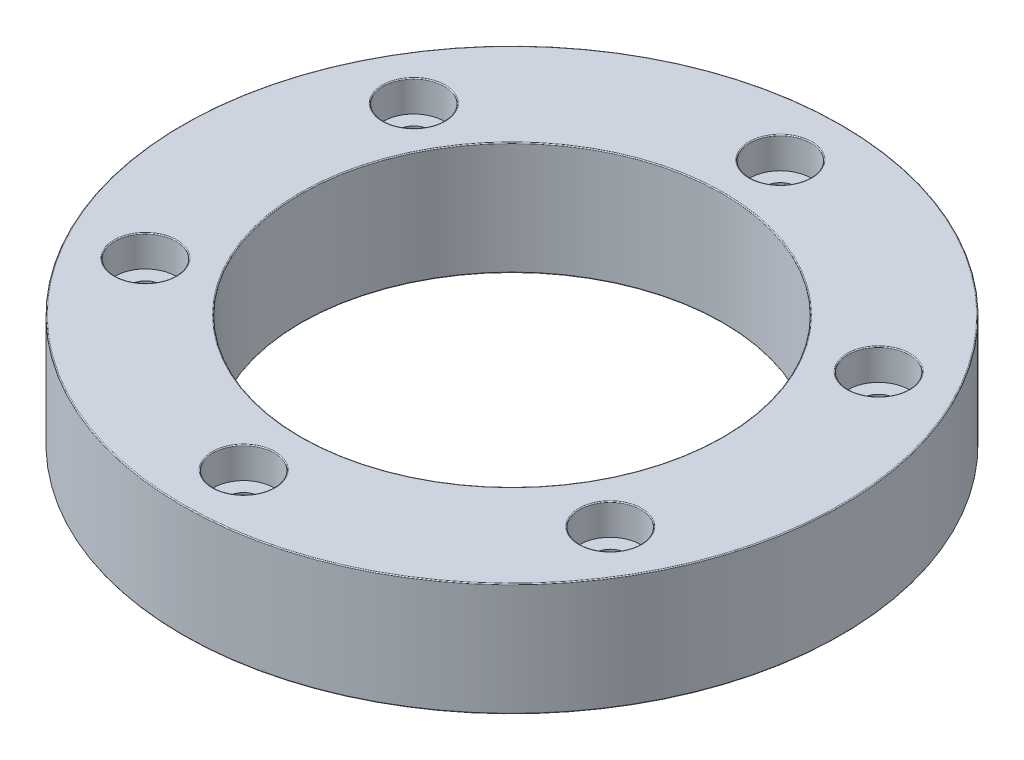
from build123d import *

# Parameters (mm, degrees)
SKETCH1_R           = 35
SKETCH1_R_2         = 22.4
BOSS_EXTRUDE1_DEPTH = 12
SKETCH2_R           = 3.25
CUT_EXTRUDE1_DEPTH  = 3.3
SKETCH3_R           = 1.7
CUT_EXTRUDE2_DEPTH  = 12
FILLET1_R           = 0.1
FILLET2_R           = 0.1


with BuildPart() as part:
    # Sketch1 → Boss-Extrude1 (new body)
    with BuildSketch(Plane(origin=(0, 0, 0), x_dir=(1, 0, 0), z_dir=(0, 1, 0))):
        with Locations(Location((0, 0, 0), (0, 0, 270))):
            Circle(SKETCH1_R)
        with Locations(Location((0, 0, 0), (0, 0, 270))):
            Circle(SKETCH1_R_2, mode=Mode.SUBTRACT)
    extrude(amount=BOSS_EXTRUDE1_DEPTH)

    # Sketch2 → Cut-Extrude1 (cut)
    with BuildSketch(Plane(origin=(0, 12, 0), x_dir=(1, 0, 0), z_dir=(0, 1, 0))):
        with Locations(Location((0, 28.5, 0), (0, 0, 270))):
            Circle(SKETCH2_R)
        with Locations(Location((24.681724008, 14.25, 0), (0, 0, 270))):
            Circle(SKETCH2_R)
        with Locations(Location((24.681724008, -14.25, 0), (0, 0, 270))):
            Circle(SKETCH2_R)
        with Locations(Location((0, -28.5, 0), (0, 0, 270))):
            Circle(SKETCH2_R)
        with Locations(Location((-24.681724008, -14.25, 0), (0, 0, 270))):
            Circle(SKETCH2_R)
        with Locations(Location((-24.681724008, 14.25, 0), (0, 0, 270))):
            Circle(SKETCH2_R)
    extrude(amount=-CUT_EXTRUDE1_DEPTH, mode=Mode.SUBTRACT)

    # Sketch3 → Cut-Extrude2 (cut)
    with BuildSketch(Plane(origin=(0, 12, 0), x_dir=(1, 0, 0), z_dir=(0, 1, 0))):
        with Locations(Location((0, 28.5, 0), (0, 0, 270))):
            Circle(SKETCH3_R)
        with Locations(Location((24.681724008, 14.25, 0), (0, 0, 270))):
            Circle(SKETCH3_R)
        with Locations(Location((24.681724008, -14.25, 0), (0, 0, 270))):
            Circle(SKETCH3_R)
        with Locations(Location((0, -28.5, 0), (0, 0, 270))):
            Circle(SKETCH3_R)
        with Locations(Location((-24.681724008, -14.25, 0), (0, 0, 270))):
            Circle(SKETCH3_R)
        with Locations(Location((-24.681724008, 14.25, 0), (0, 0, 270))):
            Circle(SKETCH3_R)
    extrude(amount=-CUT_EXTRUDE2_DEPTH, mode=Mode.SUBTRACT)

    # Fillet1
    fillet1_edges = [part.edges().sort_by_distance(p)[0] for p in [
        (0, 0, -35),
        (0, 12, -35),
        (0, 0, -22.4),
        (0, 12, -22.4),
    ]]
    fillet(fillet1_edges, radius=FILLET1_R)

    # Fillet2
    fillet2_edges = [part.edges().sort_by_distance(p)[0] for p in [
        (0, 12, 25.25),
        (-24.681724008, 12, 11),
        (-24.681724008, 12, -17.5),
        (0, 12, -31.75),
        (24.681724008, 12, -17.5),
        (24.681724008, 12, 11),
    ]]
    fillet(fillet2_edges, radius=FILLET2_R)


solid = part.part
